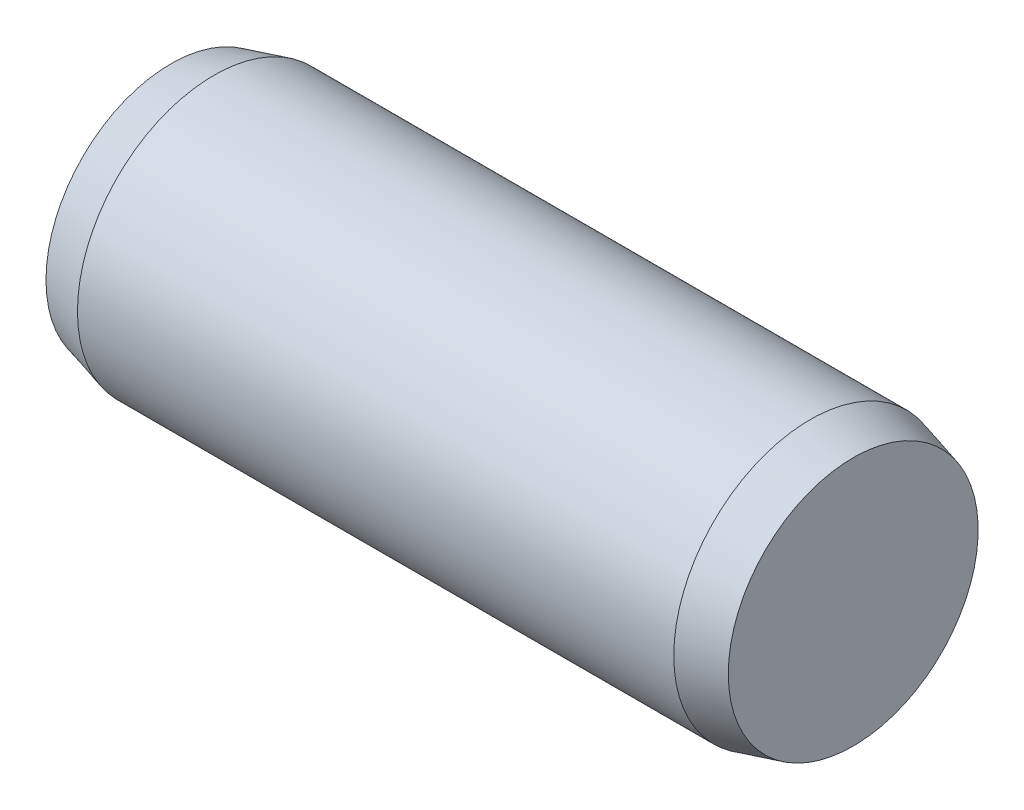
from build123d import *


with BuildPart() as part:
    # Sketch1 → Base-Revolve (revolve)
    with BuildSketch(Plane.XY, mode=Mode.PRIVATE) as base_revolve_sk:
        Polygon((0, 0), (10, 0), (10, 1.831192009), (9.37, 2), (0.63, 2), (0, 1.831192009), align=None)
    revolve(base_revolve_sk.sketch.rotate(Axis((-6.35, 0, 0), (1, 0, 0)), 90), axis=Axis((-6.35, 0, 0), (1, 0, 0)))


solid = part.part
